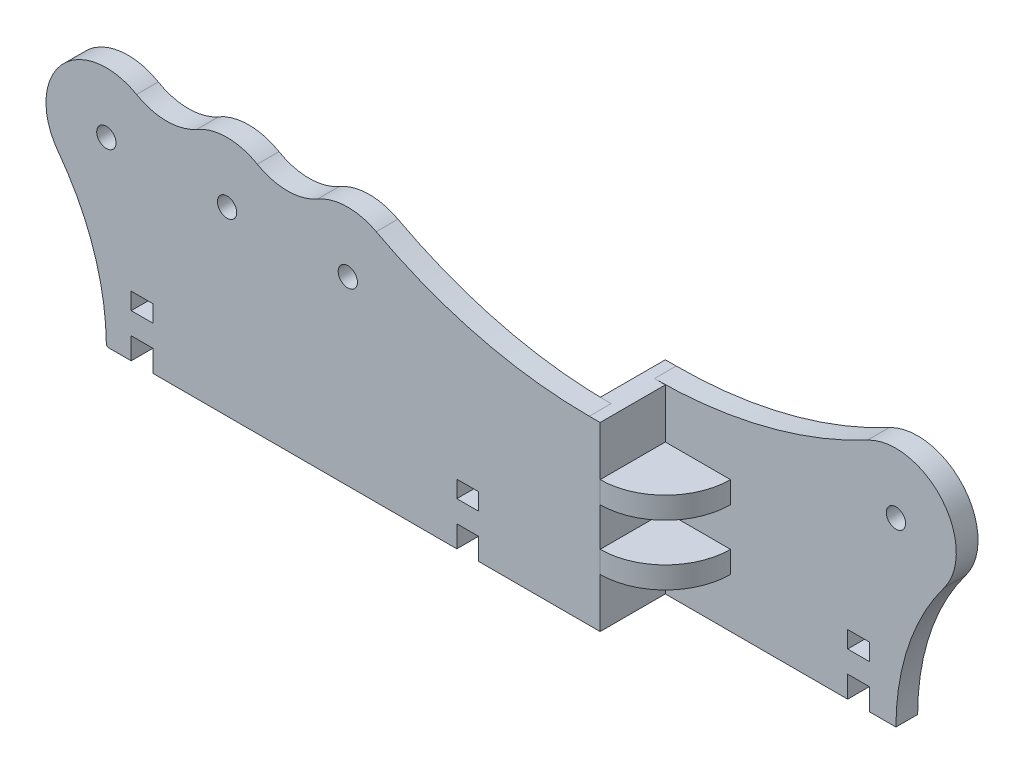
from build123d import *

# Parameters (mm, degrees)
SKETCH1_R                = 8
SKETCH1_R_2              = 4
BOSS_EXTRUDE1_DEPTH      = 9
BOSS_EXTRUDE1_2_DEPTH    = 9
SKETCH2_R                = 4
BOSS_EXTRUDE3_DEPTH      = 9
FILLET1_R                = 1
CUT_EXTRUDE1_DEPTH       = 214.789616212
SKETCH4_W                = 9
SKETCH4_H                = 27
BOSS_EXTRUDE4_DEPTH      = 75
BOSS_EXTRUDE5_START      = 9
SKETCH5_R                = 25
SKETCH5_R_2              = 4
BOSS_EXTRUDE5_DEPTH      = 9
BOSS_EXTRUDE6_DEPTH      = 4.5
BOSS_EXTRUDE6_DEPTH_BACK = 4.5
BOSS_EXTRUDE7_DEPTH      = 4.5
BOSS_EXTRUDE7_DEPTH_BACK = 4.5
BOSS_EXTRUDE7_START      = -25
SKETCH9_W                = 9
SKETCH9_H                = 7
SKETCH9_H_2              = 9
CUT_EXTRUDE2_DEPTH       = 217.612557346


with BuildPart() as part:
    # Sketch1 → Boss-Extrude1 (new body)
    with BuildSketch(Plane.XY):
        with Locations((-125, 0)):
            Circle(SKETCH1_R)
        with Locations((-125, 0)):
            Circle(SKETCH1_R_2, mode=Mode.SUBTRACT)
    extrude(amount=BOSS_EXTRUDE1_DEPTH)



with BuildPart() as body_2:
    # Sketch1 → Boss-Extrude1 2 (new body)
    with BuildSketch(Plane.XY):
        with Locations((125, 0)):
            Circle(SKETCH1_R)
        with Locations((125, 0)):
            Circle(SKETCH1_R_2, mode=Mode.SUBTRACT)
    extrude(amount=BOSS_EXTRUDE1_2_DEPTH)


with BuildPart() as part_1:
    add(part.part)

    add(body_2.part)  # Boss-Extrude3 merges body 2
    # Sketch2 → Boss-Extrude3 (add)
    with BuildSketch(Plane.XY):
        with BuildLine():
            Line((-175, -75), (125, -75))
            ThreePointArc((125, -75), (130.131670325, -43.377223009), (145.000000492, -14.999999344))
            ThreePointArc((145.000000492, -14.999999344), (143.981414944, 16.269784471), (113.235294528, 22.058823748))
            ThreePointArc((113.235294528, 22.058823748), (25.000000075, 0), (-63.235294395, 22.058823677))
            ThreePointArc((-63.235294395, 22.058823677), (-75.420498385, 24.996463372), (-87.499999896, 21.650635154))
            ThreePointArc((-87.499999896, 21.650635154), (-99.999999954, 18.301270189), (-112.500000024, 21.650635108))
            ThreePointArc((-112.500000024, 21.650635108), (-124.99999995, 25), (-137.49999989, 21.650635158))
            ThreePointArc((-137.49999989, 21.650635158), (-149.999999954, 18.301270189), (-162.50000003, 21.650635112))
            ThreePointArc((-162.50000003, 21.650635112), (-193.705072901, 16.586749162), (-195.000000551, -14.999999265))
            ThreePointArc((-195.000000551, -14.999999265), (-180.13167034, -43.377222962), (-175, -75))
        make_face()
        with Locations((125, 0)):
            Circle(SKETCH2_R, mode=Mode.SUBTRACT)
        with Locations((-175, 0)):
            Circle(SKETCH2_R, mode=Mode.SUBTRACT)
        with Locations((-125, 0)):
            Circle(SKETCH2_R, mode=Mode.SUBTRACT)
        with Locations((-75, 0)):
            Circle(SKETCH2_R, mode=Mode.SUBTRACT)
    extrude(amount=BOSS_EXTRUDE3_DEPTH)

    # Fillet1
    fillet1_edges = [part_1.edges().sort_by_distance(p)[0] for p in [
        (-175, -75, 4.5),
        (125, -75, 4.5),
    ]]
    fillet(fillet1_edges, radius=FILLET1_R)

    # Sketch3 → Cut-Extrude1 (cut, through all)
    with BuildSketch(Plane.XY):
        Polygon((25, 0), (25, -75), (150, -75), (150, 25), (25, 25), align=None)
    extrude(amount=CUT_EXTRUDE1_DEPTH, mode=Mode.SUBTRACT)

    # Sketch4 → Boss-Extrude4 (add)
    with BuildSketch(Plane.XZ.offset(75)):
        with Locations((25, -4.5)):
            Rectangle(SKETCH4_W, SKETCH4_H)
    extrude(amount=-BOSS_EXTRUDE4_DEPTH)

    # Sketch5 → Boss-Extrude5 (add)
    # profile 1 of 4: a face of its own
    with BuildSketch(Plane(origin=(0, 0, -18), x_dir=(-1, 0, 0), z_dir=(0, 0, -1)).offset(BOSS_EXTRUDE5_START)):
        with BuildLine():
            ThreePointArc((-145.000000304, -14.999999594), (-130.131670275, -43.377223158), (-125, -75))
            Line((-125, -75), (-29.5, -75))
            Line((-29.5, -75), (-29.5, 0))
            Line((-29.5, 0), (-100, 0))
            ThreePointArc((-100, 0), (-117.09430609, -23.717082532), (-145.000000304, -14.999999594))
        make_face()
    # profile 2 of 4: a face of its own
    with BuildSketch(Plane(origin=(0, 0, -18), x_dir=(-1, 0, 0), z_dir=(0, 0, -1)).offset(BOSS_EXTRUDE5_START)):
        with Locations((-125, 0)):
            Circle(SKETCH5_R)
        with Locations((-125, 0)):
            Circle(SKETCH5_R_2, mode=Mode.SUBTRACT)
    # profile 3 of 4: a face of its own
    with BuildSketch(Plane(origin=(0, 0, -18), x_dir=(-1, 0, 0), z_dir=(0, 0, -1)).offset(BOSS_EXTRUDE5_START)):
        Polygon((-29.5, 0), (-29.5, -75), (-20.5, -75), (-20.5, 0), (-25, 0), align=None)
    # profile 4 of 4: a face of its own
    with BuildSketch(Plane(origin=(0, 0, -18), x_dir=(-1, 0, 0), z_dir=(0, 0, -1)).offset(BOSS_EXTRUDE5_START)):
        with BuildLine():
            Line((-100, 0), (-29.5, 0))
            Line((-29.5, 0), (-25, 0))
            ThreePointArc((-25, 0), (-70.475429529, 5.598281181), (-113.235293817, 22.058823369))
            ThreePointArc((-113.235293817, 22.058823369), (-103.56267677, 12.86239374), (-100, 0))
        make_face()
    extrude(amount=-BOSS_EXTRUDE5_DEPTH)

    # Sketch7 → Boss-Extrude6 (add, two sides: drawn at the far end of the back side and taken through both)
    with BuildSketch(Plane(origin=(0, -25, 0), x_dir=(1, 0, 0), z_dir=(0, 1, 0)).offset(-BOSS_EXTRUDE6_DEPTH_BACK)):
        with BuildLine():
            Line((56.5, 18), (29.5, 18))
            Line((29.5, 18), (29.5, -9))
            ThreePointArc((29.5, -9), (48.591883092, -1.091883092), (56.5, 18))
        make_face()
        with BuildLine():
            Line((-6.5, 0), (20.5, 0))
            Line((20.5, 0), (20.5, 27))
            ThreePointArc((20.5, 27), (1.408116908, 19.091883092), (-6.5, 0))
        make_face()
    extrude(amount=BOSS_EXTRUDE6_DEPTH + BOSS_EXTRUDE6_DEPTH_BACK)

    # Sketch7<3> → Boss-Extrude7 (add, two sides: drawn at the far end of the back side and taken through both)
    with BuildSketch(Plane(origin=(0, -25, 0), x_dir=(1, 0, 0), z_dir=(0, 1, 0)).offset(BOSS_EXTRUDE7_START - BOSS_EXTRUDE7_DEPTH_BACK)):
        with BuildLine():
            Line((56.5, 18), (29.5, 18))
            Line((29.5, 18), (29.5, -9))
            ThreePointArc((29.5, -9), (48.591883092, -1.091883092), (56.5, 18))
        make_face()
        with BuildLine():
            Line((-6.5, 0), (20.5, 0))
            Line((20.5, 0), (20.5, 27))
            ThreePointArc((20.5, 27), (1.408116908, 19.091883092), (-6.5, 0))
        make_face()
    extrude(amount=BOSS_EXTRUDE7_DEPTH + BOSS_EXTRUDE7_DEPTH_BACK)

    # Sketch9 → Cut-Extrude2 (cut, through all)
    with BuildSketch(Plane.XY.offset(9)):
        with Locations((-160.208548161, -53.5)):
            Rectangle(SKETCH9_W, SKETCH9_H)
        with Locations((-160.208548161, -70.5)):
            Rectangle(SKETCH9_W, SKETCH9_H_2)
        with Locations((-25.351798772, -53.5)):
            Rectangle(SKETCH9_W, SKETCH9_H)
        with Locations((-25.351798772, -70.5)):
            Rectangle(SKETCH9_W, SKETCH9_H_2)
        with Locations((109.504950616, -53.5)):
            Rectangle(SKETCH9_W, SKETCH9_H)
        with Locations((109.504950616, -70.5)):
            Rectangle(SKETCH9_W, SKETCH9_H_2)
    extrude(amount=-CUT_EXTRUDE2_DEPTH, mode=Mode.SUBTRACT)


solid = part_1.part
